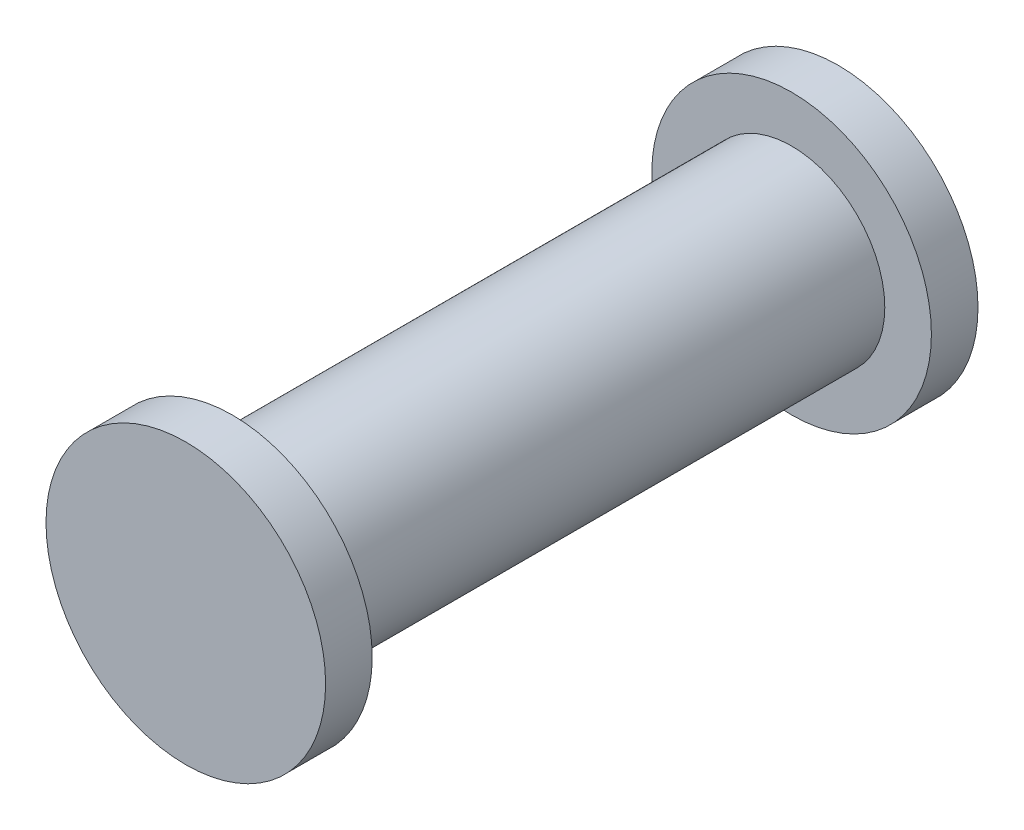
from build123d import *

# Parameters (mm, degrees)
SKETCH1_R           = 10
BOSS_EXTRUDE1_DEPTH = 60
SKETCH2_R           = 15
BOSS_EXTRUDE2_DEPTH = 5


with BuildPart() as part:
    # Sketch1 → Boss-Extrude1 (new body)
    with BuildSketch(Plane.XY):
        Circle(SKETCH1_R)
    extrude(amount=BOSS_EXTRUDE1_DEPTH)

    # Sketch2 → Boss-Extrude2 (add)
    with BuildSketch(Plane.XY.offset(60)):
        Circle(SKETCH2_R)
    boss_extrude2 = extrude(amount=BOSS_EXTRUDE2_DEPTH)

    # Mirror1: Boss-Extrude2 across plane
    add(boss_extrude2.mirror(Plane(origin=(0, 0, 30), x_dir=(1, 0, 0), z_dir=(0, 0, -1))))


solid = part.part
